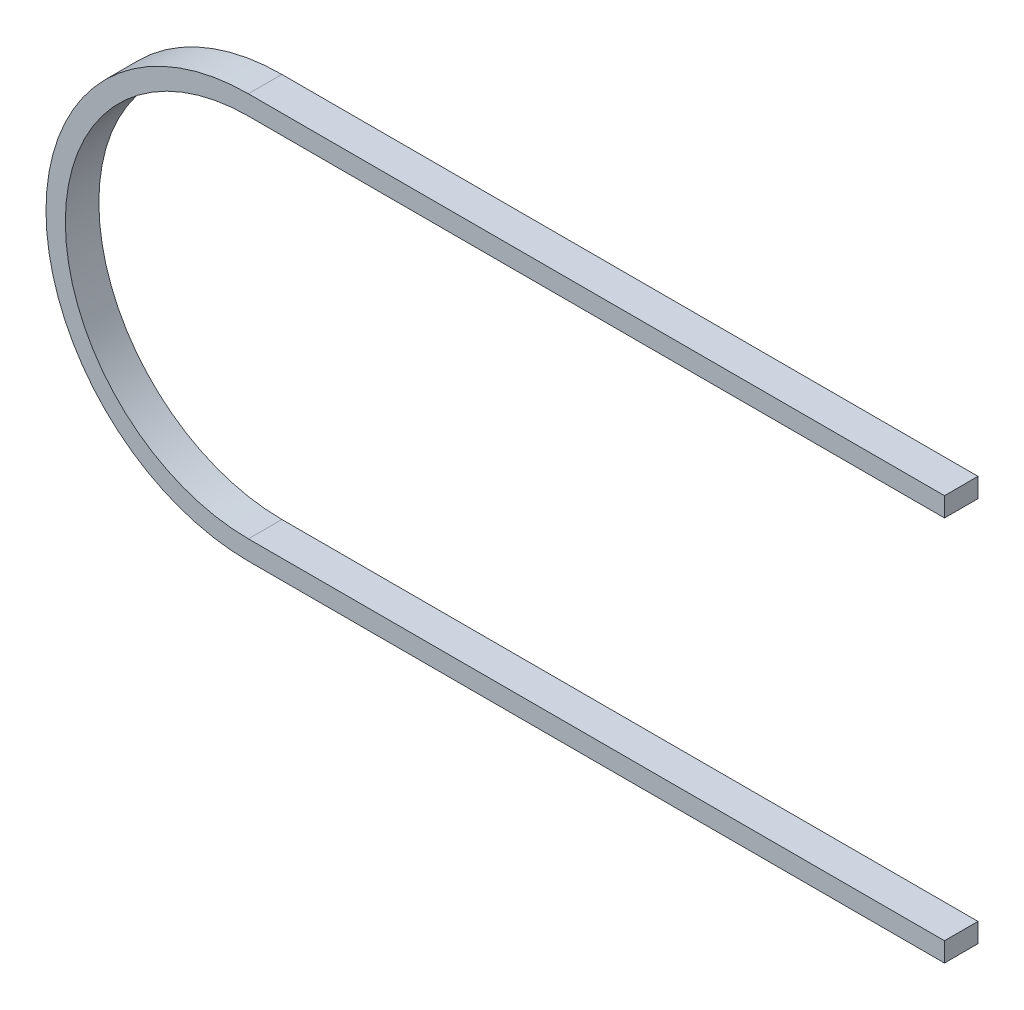
from build123d import *

# Parameters (mm, degrees)
BOSS_EXTRUDE1_DEPTH = 3.302


with BuildPart() as part:
    # Sketch1 → Boss-Extrude1 (new body)
    with BuildSketch(Plane.XY):
        with BuildLine():
            Line((0, 19.939), (68.58, 19.939))
            Line((68.58, 19.939), (68.58, 18.034))
            Line((68.58, 18.034), (0, 18.034))
            ThreePointArc((0, 18.034), (-18.034, 0), (0, -18.034))
            Line((0, -18.034), (68.58, -18.034))
            Line((68.58, -18.034), (68.58, -19.939))
            Line((68.58, -19.939), (0, -19.939))
            ThreePointArc((0, -19.939), (-19.939, 0), (0, 19.939))
        make_face()
    extrude(amount=BOSS_EXTRUDE1_DEPTH)


solid = part.part
